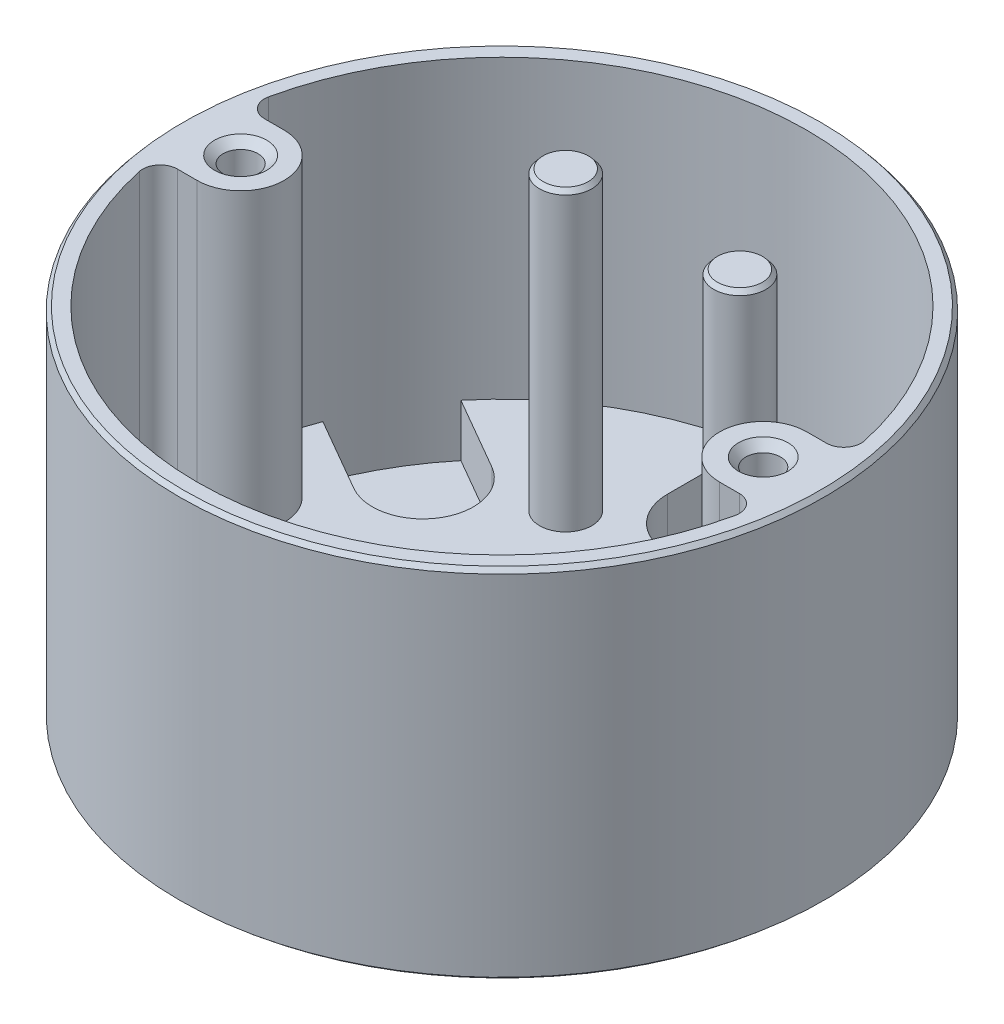
from build123d import *
from OCP.BRepFilletAPI import BRepFilletAPI_MakeChamfer

# Parameters (mm, degrees)
SKETCH1_R            = 18.5
BOSS_EXTRUDE1_DEPTH  = 20.5
SKETCH2_R            = 17.5
CUT_EXTRUDE1_DEPTH   = 17
CUT_EXTRUDE2_REACH   = 35.238
SKETCH4_R            = 5.25
BOSS_EXTRUDE2_START  = 17
SKETCH5_R            = 2.5
BOSS_EXTRUDE2_DEPTH  = 17
FILLET1_R            = 1
SKETCH6_R            = 1
CUT_EXTRUDE3_DEPTH   = 34.237779709
FILLET1_OF_MIRROR1_R = 1
SKETCH7_R            = 2.9
CUT_EXTRUDE4_DEPTH   = 3
CIRPATTERN1_COUNT    = 6
SKETCH8_R            = 6.5
CUT_EXTRUDE5_DEPTH   = 1
CUT_EXTRUDE6_REACH   = 35.238
SKETCH9_R            = 1
CUT_EXTRUDE7_REACH   = 34.932
SKETCH11_R           = 1.5
CIRPATTERN2_COUNT    = 3
SKETCH12_R           = 1.5
BOSS_EXTRUDE3_DEPTH  = 17
CHAMFER1_SIZE        = 0.5
CHAMFER1_SIZE2       = 0.419549816
CHAMFER2_SIZE        = 0.25
CHAMFER2_SIZE2       = 0.209774908
CHAMFER3_SIZE        = 0.25
CHAMFER3_SIZE2       = 0.209774908


with BuildPart() as part:
    # Sketch1 → Boss-Extrude1 (new body)
    with BuildSketch(Plane(origin=(0, 0, 0), x_dir=(1, 0, 0), z_dir=(0, 1, 0))):
        with Locations(Location((0, 0, 0), (0, 0, 270))):
            Circle(SKETCH1_R)
    extrude(amount=BOSS_EXTRUDE1_DEPTH)

    # Sketch2 → Cut-Extrude1 (cut)
    with BuildSketch(Plane(origin=(0, 20.5, 0), x_dir=(1, 0, 0), z_dir=(0, 1, 0))):
        with Locations(Location((0, 0, 0), (0, 0, 270))):
            Circle(SKETCH2_R)
    extrude(amount=-CUT_EXTRUDE1_DEPTH, mode=Mode.SUBTRACT)

    # Sketch4 → Cut-Extrude2 (cut, up to next)
    with BuildSketch(Plane.XZ, mode=Mode.PRIVATE) as cut_extrude2_sk1:
        with Locations(Location((0, 0, 0), (0, 0, 270))):
            Circle(SKETCH4_R)
    cut_extrude2_tool1 = extrude(cut_extrude2_sk1.sketch, amount=-CUT_EXTRUDE2_REACH, mode=Mode.PRIVATE) & part.part
    add(cut_extrude2_tool1.solids().sort_by_distance((0, 0, 0))[0], mode=Mode.SUBTRACT)

    # Sketch5 → Boss-Extrude2 (add)
    with BuildSketch(Plane(origin=(0, 3.5, 0), x_dir=(1, 0, 0), z_dir=(0, 1, 0)).offset(BOSS_EXTRUDE2_START)):
        with Locations((-15, 0)):
            Circle(SKETCH5_R)
        with BuildLine():
            ThreePointArc((-17.5, 0), (-16.767766953, 1.767766953), (-15, 2.5))
            Line((-15, 2.5), (-17.320508076, 2.5))
            ThreePointArc((-17.320508076, 2.5), (-17.45506934, 1.253217594), (-17.5, 0))
        make_face()
        with BuildLine():
            ThreePointArc((-15, -2.5), (-16.767766953, -1.767766953), (-17.5, 0))
            ThreePointArc((-17.5, 0), (-17.45506934, -1.253217594), (-17.320508076, -2.5))
            Line((-17.320508076, -2.5), (-15, -2.5))
        make_face()
    boss_extrude2 = extrude(amount=-BOSS_EXTRUDE2_DEPTH)

    # Fillet1
    fillet1_edges = [part.edges().sort_by_distance(p)[0] for p in [
        (-17.320508076, 12, -2.5),
        (-17.320508076, 12, 2.5),
    ]]
    fillet(fillet1_edges, radius=FILLET1_R)

    # Sketch6 → Cut-Extrude3 (cut, through all)
    with BuildSketch(Plane(origin=(0, 20.5, 0), x_dir=(1, 0, 0), z_dir=(0, 1, 0))):
        with Locations(Location((-15, 0, 0), (0, 0, 270))):
            Circle(SKETCH6_R)
    cut_extrude3 = extrude(amount=-CUT_EXTRUDE3_DEPTH, mode=Mode.SUBTRACT)

    # Mirror1: Boss-Extrude2, Cut-Extrude3 across plane
    add(boss_extrude2.mirror(Plane(origin=(0, 0, 0), x_dir=(0, 0, 1), z_dir=(1, 0, 0))))
    add(cut_extrude3.mirror(Plane(origin=(0, 0, 0), x_dir=(0, 0, 1), z_dir=(1, 0, 0))), mode=Mode.SUBTRACT)

    # Fillet1 of Mirror1
    fillet1_of_mirror1_edges = [part.edges().sort_by_distance(p)[0] for p in [
        (17.320508076, 12, -2.5),
        (17.320508076, 12, 2.5),
    ]]
    fillet(fillet1_of_mirror1_edges, radius=FILLET1_OF_MIRROR1_R)

    # Sketch7 → Cut-Extrude4 (cut)
    with BuildSketch(Plane(origin=(0, 3.5, 0), x_dir=(1, 0, 0), z_dir=(0, 1, 0))):
        with Locations((0, 12.4)):
            Circle(SKETCH7_R)
        with BuildLine():
            Line((-2.9, 17.258041604), (-2.9, 12.4))
            ThreePointArc((-2.9, 12.4), (0, 15.3), (2.9, 12.4))
            Line((2.9, 12.4), (2.9, 17.258041604))
            ThreePointArc((2.9, 17.258041604), (0, 17.5), (-2.9, 17.258041604))
        make_face()
    cut_extrude4 = extrude(amount=-CUT_EXTRUDE4_DEPTH, mode=Mode.SUBTRACT)

    # CirPattern1: Cut-Extrude4 ×6 about axis
    cirpattern1_axis = Axis((0, 0, 0), (0, 1, 0))
    for i in range(1, CIRPATTERN1_COUNT):
        add(cut_extrude4.rotate(cirpattern1_axis, i * 360 / CIRPATTERN1_COUNT), mode=Mode.SUBTRACT)

    # Sketch8 → Cut-Extrude5 (cut)
    with BuildSketch(Plane.XZ):
        with Locations(Location((0, 0, 0), (0, 0, 270))):
            Circle(SKETCH8_R)
    extrude(amount=-CUT_EXTRUDE5_DEPTH, mode=Mode.SUBTRACT)

    # Sketch9 → Cut-Extrude6 (cut, up to next)
    with BuildSketch(Plane.XZ, mode=Mode.PRIVATE) as cut_extrude6_sk1:
        with Locations(Location((-8, 0, 0), (0, 0, 270))):
            Circle(SKETCH9_R)
    cut_extrude6_tool1 = extrude(cut_extrude6_sk1.sketch, amount=-CUT_EXTRUDE6_REACH, mode=Mode.PRIVATE) & part.part
    # Sketch9 → Cut-Extrude6 (cut, up to next)
    with BuildSketch(Plane.XZ, mode=Mode.PRIVATE) as cut_extrude6_sk2:
        with Locations(Location((8, 0, 0), (0, 0, 270))):
            Circle(SKETCH9_R)
    cut_extrude6_tool2 = extrude(cut_extrude6_sk2.sketch, amount=-CUT_EXTRUDE6_REACH, mode=Mode.PRIVATE) & part.part
    add(cut_extrude6_tool1.solids().sort_by_distance((-8, 0, 0))[0], mode=Mode.SUBTRACT)
    add(cut_extrude6_tool2.solids().sort_by_distance((8, 0, 0))[0], mode=Mode.SUBTRACT)

    # Sketch11 → Cut-Extrude7 (cut, up to next)
    with BuildSketch(Plane(origin=(0, 0.5, 0), x_dir=(1, 0, 0), z_dir=(0, 1, 0)), mode=Mode.PRIVATE) as cut_extrude7_sk1:
        with Locations(Location((0, 12.5, 0), (0, 0, 270))):
            Circle(SKETCH11_R)
    cut_extrude7_tool1 = extrude(cut_extrude7_sk1.sketch, amount=-CUT_EXTRUDE7_REACH, mode=Mode.PRIVATE) & part.part
    cut_extrude7 = cut_extrude7_tool1.solids().sort_by_distance((0, 0.5, -12.5))[0]
    add(cut_extrude7, mode=Mode.SUBTRACT)

    # CirPattern2: Cut-Extrude7 ×3 about axis
    cirpattern2_axis = Axis((0, 0, 0), (0, 1, 0))
    for i in range(1, CIRPATTERN2_COUNT):
        add(cut_extrude7.rotate(cirpattern2_axis, i * 360 / CIRPATTERN2_COUNT), mode=Mode.SUBTRACT)

    # Sketch12 → Boss-Extrude3 (add)
    with BuildSketch(Plane(origin=(0, 3.5, 0), x_dir=(1, 0, 0), z_dir=(0, 1, 0))):
        with Locations(Location((-5, 8.660254038, 0), (0, 0, 270))):
            Circle(SKETCH12_R)
        with Locations(Location((5, 8.660254038, 0), (0, 0, 270))):
            Circle(SKETCH12_R)
    extrude(amount=BOSS_EXTRUDE3_DEPTH)

    # Chamfer1: one chamfer whose edges measure the first distance from different faces: ONE call of the kernel's chamfer builder (chamfer() names one face for all edges)
    chamfer1_edges_1 = [part.edges().sort_by_distance(p)[0] for p in [
        (-15, 20.5, -1),
    ]]
    chamfer1_side_1 = [part.faces().sort_by_distance(p)[0] for p in [
        (0, 20.5, -18.023259018),
    ]]
    chamfer1_edges_2 = [part.edges().sort_by_distance(p)[0] for p in [
        (15, 20.5, -1),
    ]]
    chamfer1_side_2 = [part.faces().sort_by_distance(p)[0] for p in [
        (15, 10.25, -1),
    ]]
    chamfer1 = BRepFilletAPI_MakeChamfer(part.part.solid().wrapped)
    for e in chamfer1_edges_1:
        chamfer1.Add(CHAMFER1_SIZE, CHAMFER1_SIZE2, e.wrapped, chamfer1_side_1[0].wrapped)  # the first distance lies on this face
    for e in chamfer1_edges_2:
        chamfer1.Add(CHAMFER1_SIZE, CHAMFER1_SIZE2, e.wrapped, chamfer1_side_2[0].wrapped)  # the first distance lies on this face
    add(Compound.cast(chamfer1.Shape()), mode=Mode.REPLACE)

    # Chamfer2: one chamfer whose edges measure the first distance from different faces: ONE call of the kernel's chamfer builder (chamfer() names one face for all edges)
    chamfer2_edges_1 = [part.edges().sort_by_distance(p)[0] for p in [
        (-5, 20.5, -10.160254038),
    ]]
    chamfer2_side_1 = [part.faces().sort_by_distance(p)[0] for p in [
        (-5, 12, -10.160254038),
    ]]
    chamfer2_edges_2 = [part.edges().sort_by_distance(p)[0] for p in [
        (5, 20.5, -10.160254038),
    ]]
    chamfer2_side_2 = [part.faces().sort_by_distance(p)[0] for p in [
        (5, 12, -10.160254038),
    ]]
    chamfer2 = BRepFilletAPI_MakeChamfer(part.part.solid().wrapped)
    for e in chamfer2_edges_1:
        chamfer2.Add(CHAMFER2_SIZE, CHAMFER2_SIZE2, e.wrapped, chamfer2_side_1[0].wrapped)  # the first distance lies on this face
    for e in chamfer2_edges_2:
        chamfer2.Add(CHAMFER2_SIZE, CHAMFER2_SIZE2, e.wrapped, chamfer2_side_2[0].wrapped)  # the first distance lies on this face
    add(Compound.cast(chamfer2.Shape()), mode=Mode.REPLACE)

    # Chamfer3: one chamfer whose edges measure the first distance from different faces: ONE call of the kernel's chamfer builder (chamfer() names one face for all edges)
    chamfer3_edges_1 = [part.edges().sort_by_distance(p)[0] for p in [
        (0, 0, -18.5),
    ]]
    chamfer3_side_1 = [part.faces().sort_by_distance(p)[0] for p in [
        (0, 0, -17.976740982),
    ]]
    chamfer3_edges_2 = [part.edges().sort_by_distance(p)[0] for p in [
        (0, 20.5, -18.5),
    ]]
    chamfer3_side_2 = [part.faces().sort_by_distance(p)[0] for p in [
        (0, 10.25, -18.5),
    ]]
    chamfer3 = BRepFilletAPI_MakeChamfer(part.part.solid().wrapped)
    for e in chamfer3_edges_1:
        chamfer3.Add(CHAMFER3_SIZE, CHAMFER3_SIZE2, e.wrapped, chamfer3_side_1[0].wrapped)  # the first distance lies on this face
    for e in chamfer3_edges_2:
        chamfer3.Add(CHAMFER3_SIZE, CHAMFER3_SIZE2, e.wrapped, chamfer3_side_2[0].wrapped)  # the first distance lies on this face
    add(Compound.cast(chamfer3.Shape()), mode=Mode.REPLACE)


solid = part.part
